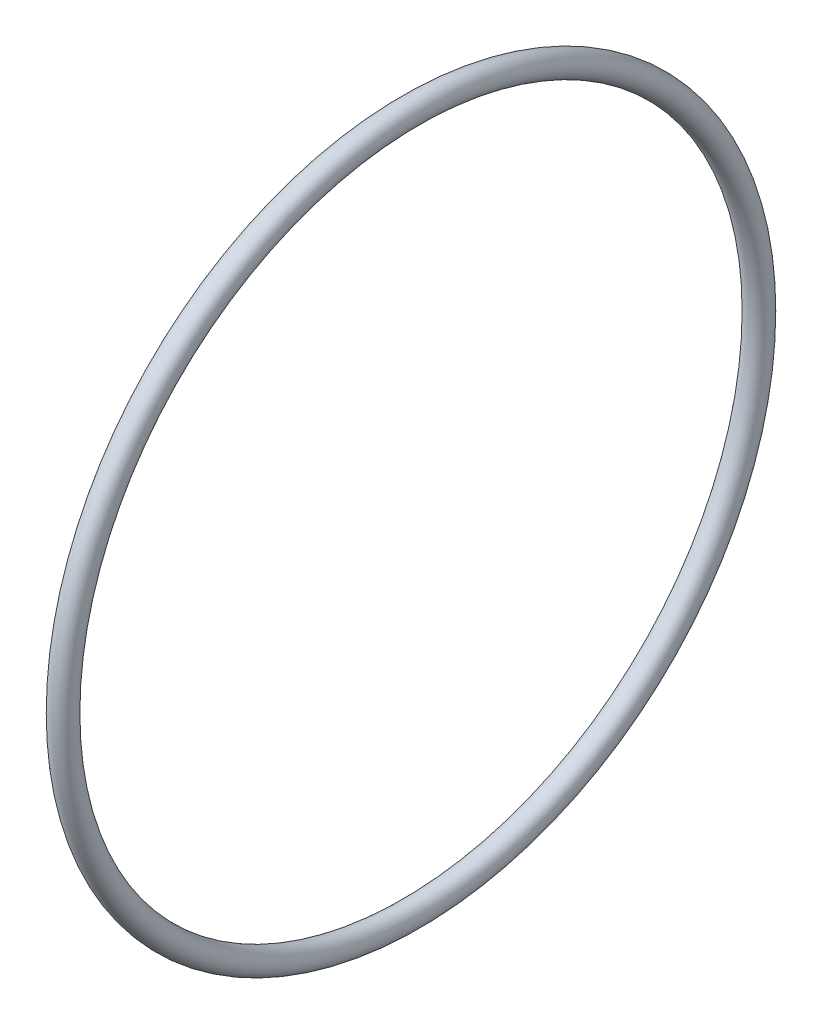
from build123d import *

# Parameters (mm, degrees)
SKETCH_1_R = 0.65


with BuildPart() as part:
    # 草图1 → 旋转1 (revolve)
    with BuildSketch(Plane.XY, mode=Mode.PRIVATE) as revolve_1_sk:
        with Locations((0, 19)):
            Circle(SKETCH_1_R)
    revolve(revolve_1_sk.sketch.rotate(Axis((0, 0, 0), (1, 0, 0)), 90), axis=Axis((0, 0, 0), (1, 0, 0)))


solid = part.part
